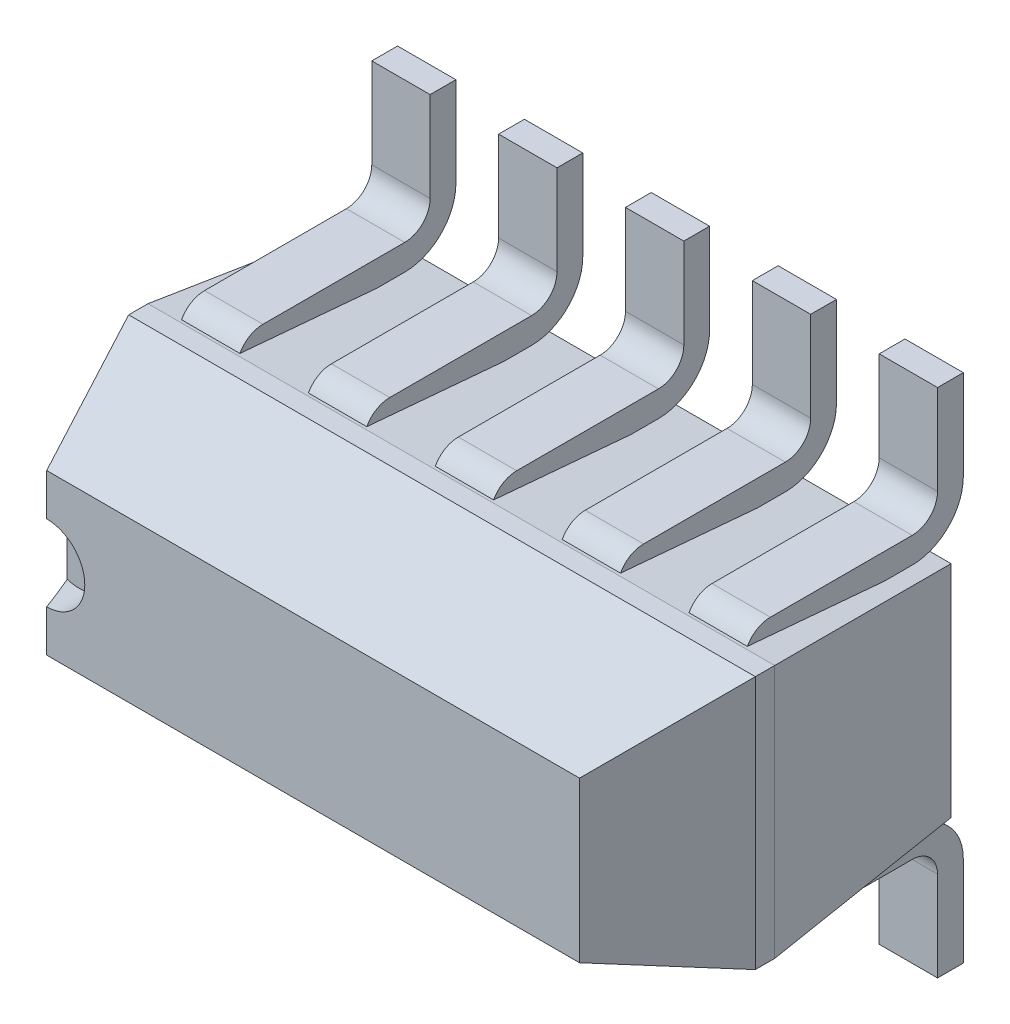
from build123d import *
from OCP.BRepFilletAPI import BRepFilletAPI_MakeChamfer

# Parameters (mm, degrees)
SKETCH1_W                = 2.47
SKETCH1_H                = 1
BASE_EXTRUDE_DEPTH       = 1.3462
CHAMFER1_SIZE            = 0.508
CHAMFER1_SIZE2           = 0.184896879
CHAMFER2_SIZE            = 0.762
CHAMFER2_SIZE2           = 0.066666362
SKETCH3_R                = 0.15
CUT_EXTRUDE1_DEPTH       = 0.127
BOSS_EXTRUDE_THIN3_DEPTH = 0.115
LPATTERN1_COUNT          = 5
LPATTERN1_PITCH          = 0.5
MIRROR1_COPY_1_DEPTH     = 0.115
MIRROR1_COPY_2_DEPTH     = 0.115
MIRROR1_COPY_3_DEPTH     = 0.115
MIRROR1_COPY_4_DEPTH     = 0.115


with BuildPart() as part:
    # Sketch1 → Base-Extrude (new body)
    with BuildSketch(Plane.XY):
        with Locations((3.115498433, 1.262)):
            Rectangle(SKETCH1_W, SKETCH1_H)
    extrude(amount=BASE_EXTRUDE_DEPTH)

    # Chamfer1: one chamfer whose edges measure the first distance from different faces: ONE call of the kernel's chamfer builder (chamfer() names one face for all edges)
    chamfer1_edges_1 = [part.edges().sort_by_distance(p)[0] for p in [
        (4.350498433, 1.262, 1.3462),
    ]]
    chamfer1_side_1 = [part.faces().sort_by_distance(p)[0] for p in [
        (4.350498433, 1.262, 0.6731),
    ]]
    chamfer1_edges_2 = [part.edges().sort_by_distance(p)[0] for p in [
        (3.115498433, 1.762, 1.3462),
    ]]
    chamfer1_side_2 = [part.faces().sort_by_distance(p)[0] for p in [
        (3.115498433, 1.762, 0.6731),
    ]]
    chamfer1_edges_3 = [part.edges().sort_by_distance(p)[0] for p in [
        (1.880498433, 1.262, 1.3462),
    ]]
    chamfer1_side_3 = [part.faces().sort_by_distance(p)[0] for p in [
        (1.880498433, 1.262, 0.6731),
    ]]
    chamfer1_edges_4 = [part.edges().sort_by_distance(p)[0] for p in [
        (3.115498433, 0.762, 1.3462),
    ]]
    chamfer1_side_4 = [part.faces().sort_by_distance(p)[0] for p in [
        (3.115498433, 0.762, 0.6731),
    ]]
    chamfer1 = BRepFilletAPI_MakeChamfer(part.part.solid().wrapped)
    for e in chamfer1_edges_1:
        chamfer1.Add(CHAMFER1_SIZE, CHAMFER1_SIZE2, e.wrapped, chamfer1_side_1[0].wrapped)  # the first distance lies on this face
    for e in chamfer1_edges_2:
        chamfer1.Add(CHAMFER1_SIZE, CHAMFER1_SIZE2, e.wrapped, chamfer1_side_2[0].wrapped)  # the first distance lies on this face
    for e in chamfer1_edges_3:
        chamfer1.Add(CHAMFER1_SIZE, CHAMFER1_SIZE2, e.wrapped, chamfer1_side_3[0].wrapped)  # the first distance lies on this face
    for e in chamfer1_edges_4:
        chamfer1.Add(CHAMFER1_SIZE, CHAMFER1_SIZE2, e.wrapped, chamfer1_side_4[0].wrapped)  # the first distance lies on this face
    add(Compound.cast(chamfer1.Shape()), mode=Mode.REPLACE)

    # Chamfer2: one chamfer whose edges measure the first distance from different faces: ONE call of the kernel's chamfer builder (chamfer() names one face for all edges)
    chamfer2_edges_1 = [part.edges().sort_by_distance(p)[0] for p in [
        (3.115498433, 1.762, 0),
    ]]
    chamfer2_side_1 = [part.faces().sort_by_distance(p)[0] for p in [
        (3.115498433, 1.762, 0.4191),
    ]]
    chamfer2_edges_2 = [part.edges().sort_by_distance(p)[0] for p in [
        (4.350498433, 1.262, 0),
    ]]
    chamfer2_side_2 = [part.faces().sort_by_distance(p)[0] for p in [
        (4.350498433, 1.262, 0.4191),
    ]]
    chamfer2_edges_3 = [part.edges().sort_by_distance(p)[0] for p in [
        (3.115498433, 0.762, 0),
    ]]
    chamfer2_side_3 = [part.faces().sort_by_distance(p)[0] for p in [
        (3.115498433, 0.762, 0.4191),
    ]]
    chamfer2_edges_4 = [part.edges().sort_by_distance(p)[0] for p in [
        (1.880498433, 1.262, 0),
    ]]
    chamfer2_side_4 = [part.faces().sort_by_distance(p)[0] for p in [
        (1.880498433, 1.262, 0.4191),
    ]]
    chamfer2 = BRepFilletAPI_MakeChamfer(part.part.solid().wrapped)
    for e in chamfer2_edges_1:
        chamfer2.Add(CHAMFER2_SIZE, CHAMFER2_SIZE2, e.wrapped, chamfer2_side_1[0].wrapped)  # the first distance lies on this face
    for e in chamfer2_edges_2:
        chamfer2.Add(CHAMFER2_SIZE, CHAMFER2_SIZE2, e.wrapped, chamfer2_side_2[0].wrapped)  # the first distance lies on this face
    for e in chamfer2_edges_3:
        chamfer2.Add(CHAMFER2_SIZE, CHAMFER2_SIZE2, e.wrapped, chamfer2_side_3[0].wrapped)  # the first distance lies on this face
    for e in chamfer2_edges_4:
        chamfer2.Add(CHAMFER2_SIZE, CHAMFER2_SIZE2, e.wrapped, chamfer2_side_4[0].wrapped)  # the first distance lies on this face
    add(Compound.cast(chamfer2.Shape()), mode=Mode.REPLACE)

    # Sketch3 → Cut-Extrude1 (cut)
    with BuildSketch(Plane(origin=(0.118935742, 0.142956615, 1.3462), x_dir=(1, 0, 0), z_dir=(0, 0, 1))):
        with Locations((1.946665812, 1.119043385)):
            Circle(SKETCH3_R)
    extrude(amount=-CUT_EXTRUDE1_DEPTH, mode=Mode.SUBTRACT)

    # Sketch4 → Boss-Extrude-Thin3 (add, symmetric)
    with BuildSketch(Plane(origin=(2.115498433, 0, 0), x_dir=(0, 0, -1), z_dir=(1, 0, 0))):
        with BuildLine():
            ThreePointArc((-0.762, 0.812000071), (-0.73177342, 0.739026651), (-0.6588, 0.708800071))
            Line((-0.6588, 0.708800071), (-0.1, 0.708800071))
            ThreePointArc((-0.1, 0.708800071), (-0.029289322, 0.679510749), (0, 0.608800071))
            Line((0, 0.608800071), (0, 0.254259822))
            Line((0, 0.254259822), (0.1016, 0.254259822))
            Line((0.1016, 0.254259822), (0.1016, 0.608800071))
            ThreePointArc((0.1016, 0.608800071), (0.042552727, 0.751352798), (-0.1, 0.810400071))
            Line((-0.1, 0.810400071), (-0.6588, 0.810400071))
            ThreePointArc((-0.6588, 0.810400071), (-0.659931371, 0.8108687), (-0.6604, 0.812000071))
            Line((-0.6604, 0.812000071), (-0.762, 0.812000071))
        make_face()
    boss_extrude_thin3 = extrude(amount=BOSS_EXTRUDE_THIN3_DEPTH, both=True)

    # LPattern1: Boss-Extrude-Thin3 ×5
    with Locations(*[(i * LPATTERN1_PITCH, 0, 0) for i in range(1, LPATTERN1_COUNT)]):
        add(boss_extrude_thin3)

    # Mirror1: Boss-Extrude-Thin3 across plane
    add(boss_extrude_thin3.mirror(Plane.ZX.offset(1.262)))

    # Mirror1 copy 1 sketch → Mirror1 copy 1 (add, symmetric)
    with BuildSketch(Plane(origin=(2.615498433, 2.524, 0), x_dir=(0, 0, -1), z_dir=(1, 0, 0))):
        with BuildLine():
            ThreePointArc((-0.762, -0.812000071), (-0.73177342, -0.739026651), (-0.6588, -0.708800071))
            Line((-0.6588, -0.708800071), (-0.1, -0.708800071))
            ThreePointArc((-0.1, -0.708800071), (-0.029289322, -0.679510749), (0, -0.608800071))
            Line((0, -0.608800071), (0, -0.254259822))
            Line((0, -0.254259822), (0.1016, -0.254259822))
            Line((0.1016, -0.254259822), (0.1016, -0.608800071))
            ThreePointArc((0.1016, -0.608800071), (0.042552727, -0.751352798), (-0.1, -0.810400071))
            Line((-0.1, -0.810400071), (-0.6588, -0.810400071))
            ThreePointArc((-0.6588, -0.810400071), (-0.659931371, -0.8108687), (-0.6604, -0.812000071))
            Line((-0.6604, -0.812000071), (-0.762, -0.812000071))
        make_face()
    extrude(amount=MIRROR1_COPY_1_DEPTH, both=True)

    # Mirror1 copy 2 sketch → Mirror1 copy 2 (add, symmetric)
    with BuildSketch(Plane(origin=(3.115498433, 2.524, 0), x_dir=(0, 0, -1), z_dir=(1, 0, 0))):
        with BuildLine():
            ThreePointArc((-0.762, -0.812000071), (-0.73177342, -0.739026651), (-0.6588, -0.708800071))
            Line((-0.6588, -0.708800071), (-0.1, -0.708800071))
            ThreePointArc((-0.1, -0.708800071), (-0.029289322, -0.679510749), (0, -0.608800071))
            Line((0, -0.608800071), (0, -0.254259822))
            Line((0, -0.254259822), (0.1016, -0.254259822))
            Line((0.1016, -0.254259822), (0.1016, -0.608800071))
            ThreePointArc((0.1016, -0.608800071), (0.042552727, -0.751352798), (-0.1, -0.810400071))
            Line((-0.1, -0.810400071), (-0.6588, -0.810400071))
            ThreePointArc((-0.6588, -0.810400071), (-0.659931371, -0.8108687), (-0.6604, -0.812000071))
            Line((-0.6604, -0.812000071), (-0.762, -0.812000071))
        make_face()
    extrude(amount=MIRROR1_COPY_2_DEPTH, both=True)

    # Mirror1 copy 3 sketch → Mirror1 copy 3 (add, symmetric)
    with BuildSketch(Plane(origin=(3.615498433, 2.524, 0), x_dir=(0, 0, -1), z_dir=(1, 0, 0))):
        with BuildLine():
            ThreePointArc((-0.762, -0.812000071), (-0.73177342, -0.739026651), (-0.6588, -0.708800071))
            Line((-0.6588, -0.708800071), (-0.1, -0.708800071))
            ThreePointArc((-0.1, -0.708800071), (-0.029289322, -0.679510749), (0, -0.608800071))
            Line((0, -0.608800071), (0, -0.254259822))
            Line((0, -0.254259822), (0.1016, -0.254259822))
            Line((0.1016, -0.254259822), (0.1016, -0.608800071))
            ThreePointArc((0.1016, -0.608800071), (0.042552727, -0.751352798), (-0.1, -0.810400071))
            Line((-0.1, -0.810400071), (-0.6588, -0.810400071))
            ThreePointArc((-0.6588, -0.810400071), (-0.659931371, -0.8108687), (-0.6604, -0.812000071))
            Line((-0.6604, -0.812000071), (-0.762, -0.812000071))
        make_face()
    extrude(amount=MIRROR1_COPY_3_DEPTH, both=True)

    # Mirror1 copy 4 sketch → Mirror1 copy 4 (add, symmetric)
    with BuildSketch(Plane(origin=(4.115498433, 2.524, 0), x_dir=(0, 0, -1), z_dir=(1, 0, 0))):
        with BuildLine():
            ThreePointArc((-0.762, -0.812000071), (-0.73177342, -0.739026651), (-0.6588, -0.708800071))
            Line((-0.6588, -0.708800071), (-0.1, -0.708800071))
            ThreePointArc((-0.1, -0.708800071), (-0.029289322, -0.679510749), (0, -0.608800071))
            Line((0, -0.608800071), (0, -0.254259822))
            Line((0, -0.254259822), (0.1016, -0.254259822))
            Line((0.1016, -0.254259822), (0.1016, -0.608800071))
            ThreePointArc((0.1016, -0.608800071), (0.042552727, -0.751352798), (-0.1, -0.810400071))
            Line((-0.1, -0.810400071), (-0.6588, -0.810400071))
            ThreePointArc((-0.6588, -0.810400071), (-0.659931371, -0.8108687), (-0.6604, -0.812000071))
            Line((-0.6604, -0.812000071), (-0.762, -0.812000071))
        make_face()
    extrude(amount=MIRROR1_COPY_4_DEPTH, both=True)


solid = part.part
